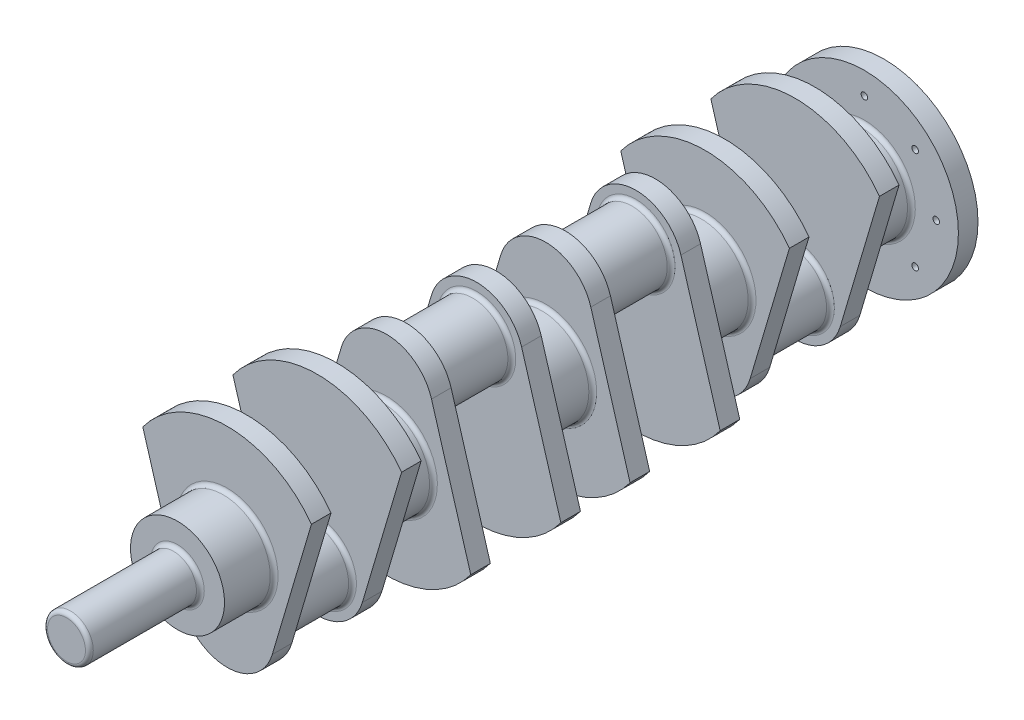
from build123d import *

# Parameters (mm, degrees)
SKETCH1_R             = 36
BOSS_EXTRUDE1_DEPTH   = 15
SKETCH2_R             = 27
BOSS_EXTRUDE2_DEPTH   = 54
SKETCH3_R             = 36
BOSS_EXTRUDE3_DEPTH   = 38
BODY_MOVE_COPY1_ANGLE = 180
SKETCH4_R             = 17.5
BOSS_EXTRUDE4_DEPTH   = 85
SKETCH5_R             = 72
SKETCH5_R_2           = 2.5
BOSS_EXTRUDE5_DEPTH   = 15
FILLET1_R             = 3


with BuildPart() as part:
    # Sketch1 → Boss-Extrude1 (new body)
    with BuildSketch(Plane.XY):
        with BuildLine():
            ThreePointArc((64.569893475, 47.23059238), (0, 80), (-64.569893475, 47.23059238))
            Line((-64.569893475, 47.23059238), (-34.517510455, -54.224552409))
            ThreePointArc((-34.517510455, -54.224552409), (-5.165734392, -8.372550074), (36, -44))
            ThreePointArc((36, -44), (35.627449926, -49.165734392), (34.517510455, -54.224552409))
            Line((34.517510455, -54.224552409), (64.569893475, 47.23059238))
        make_face()
        with Locations((0, -44)):
            Circle(SKETCH1_R)
    boss_extrude1 = extrude(amount=BOSS_EXTRUDE1_DEPTH)

    # Sketch2 → Boss-Extrude2 (add)
    with BuildSketch(Plane(origin=(0, 0, 0), x_dir=(-1, 0, 0), z_dir=(0, 0, -1))):
        with Locations((0, -44)):
            Circle(SKETCH2_R)
    extrude(amount=BOSS_EXTRUDE2_DEPTH)

    # Sketch3 → Boss-Extrude3 (add)
    with BuildSketch(Plane.XY.offset(15)):
        Circle(SKETCH3_R)
    boss_extrude3 = extrude(amount=BOSS_EXTRUDE3_DEPTH)

    # Mirror1: Boss-Extrude1, Boss-Extrude3 across plane
    add(boss_extrude1.mirror(Plane(origin=(0, 0, -27), x_dir=(1, 0, 0), z_dir=(0, 0, -1))))
    add(boss_extrude3.mirror(Plane(origin=(0, 0, -27), x_dir=(1, 0, 0), z_dir=(0, 0, -1))))


with BuildPart() as body_2:
    # Mirror2: mirrored copy
    add(part.part.mirror(Plane(origin=(0, 0, -88), x_dir=(1, 0, 0), z_dir=(0, 0, -1))))


with BuildPart() as body_2_1:
    # Body-Move/Copy1: moved
    add(body_2.part.rotate(Axis((0, 0, -149), (1, 0, 0)), BODY_MOVE_COPY1_ANGLE))


with BuildPart() as body_3:
    # Mirror3: mirrored copy
    add(body_2_1.part.mirror(Plane(origin=(0, 0, -210), x_dir=(1, 0, 0), z_dir=(0, 0, -1))))


with BuildPart() as body_4:
    # Mirror3 2: mirrored copy
    add(part.part.mirror(Plane(origin=(0, 0, -210), x_dir=(1, 0, 0), z_dir=(0, 0, -1))))

    # Sketch5 → Boss-Extrude5 (add)
    with BuildSketch(Plane(origin=(0, 0, -473), x_dir=(-1, 0, 0), z_dir=(0, 0, -1))):
        with Locations(Location((0, 0, 0), (0, 0, 90))):
            Circle(SKETCH5_R)
        with Locations(Location((0, 55, 0), (0, 0, 90))):
            Circle(SKETCH5_R_2, mode=Mode.SUBTRACT)
        with Locations(Location((38.890872965, 38.890872965, 0), (0, 0, 90))):
            Circle(SKETCH5_R_2, mode=Mode.SUBTRACT)
        with Locations(Location((55, 0, 0), (0, 0, 90))):
            Circle(SKETCH5_R_2, mode=Mode.SUBTRACT)
        with Locations(Location((38.890872965, -38.890872965, 0), (0, 0, 90))):
            Circle(SKETCH5_R_2, mode=Mode.SUBTRACT)
        with Locations(Location((0, -55, 0), (0, 0, 90))):
            Circle(SKETCH5_R_2, mode=Mode.SUBTRACT)
        with Locations(Location((-38.890872965, -38.890872965, 0), (0, 0, 90))):
            Circle(SKETCH5_R_2, mode=Mode.SUBTRACT)
        with Locations(Location((-55, 0, 0), (0, 0, 90))):
            Circle(SKETCH5_R_2, mode=Mode.SUBTRACT)
        with Locations(Location((-38.890872965, 38.890872965, 0), (0, 0, 90))):
            Circle(SKETCH5_R_2, mode=Mode.SUBTRACT)
    extrude(amount=BOSS_EXTRUDE5_DEPTH)


with BuildPart() as part_1:
    add(part.part)

    # Sketch4 → Boss-Extrude4 (add)
    with BuildSketch(Plane.XY.offset(53)):
        Circle(SKETCH4_R)
    extrude(amount=BOSS_EXTRUDE4_DEPTH)

    # Combine1: union body 2, body 3, body 4
    add(body_2_1.part)
    add(body_3.part)
    add(body_4.part)

    # Fillet1
    fillet1_edges = [part_1.edges().sort_by_distance(p)[0] for p in [
        (27, -44, 0),
        (27, -44, -54),
        (-36, 0, 15),
        (-36, 0, -69),
        (-17.5, 0, 53),
        (-17.5, 0, 138),
        (-36, 0, -107),
        (27, 44, -122),
        (27, 44, -176),
        (-36, 0, -191),
        (27, 44, -298),
        (-36, 0, -313),
        (-36, 0, -229),
        (27, 44, -244),
        (-36, 0, -435),
        (27, -44, -420),
        (27, -44, -366),
        (-36, 0, -473),
        (-36, 0, -351),
    ]]
    fillet(fillet1_edges, radius=FILLET1_R)


solid = part_1.part
